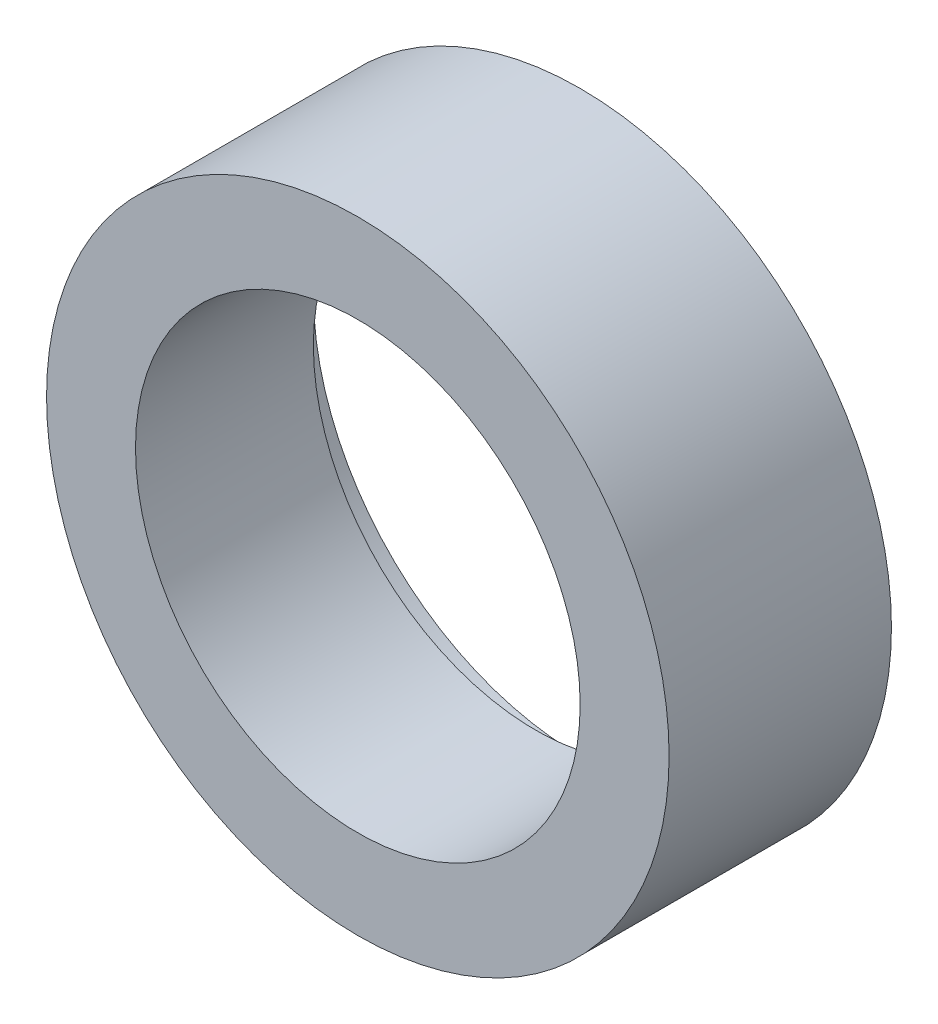
from build123d import *

# Parameters (mm, degrees)
SKETCH1_W = 3.175
SKETCH1_H = 12.7


with BuildPart() as part:
    # Sketch1 → Revolve1 (revolve)
    with BuildSketch(Plane(origin=(0, 0, 0), x_dir=(1, 0, 0), z_dir=(0, 1, 0))):
        with Locations((17.4625, -1.5875)):
            Rectangle(SKETCH1_W, SKETCH1_H)
        Polygon((19.05, 4.7625), (19.05, -7.9375), (22.225, -7.9375), (22.225, 7.9375), (19.05, 7.9375), align=None)
    revolve(axis=Axis((0, 0, -0.348280893), (0, 0, -1)))


solid = part.part
